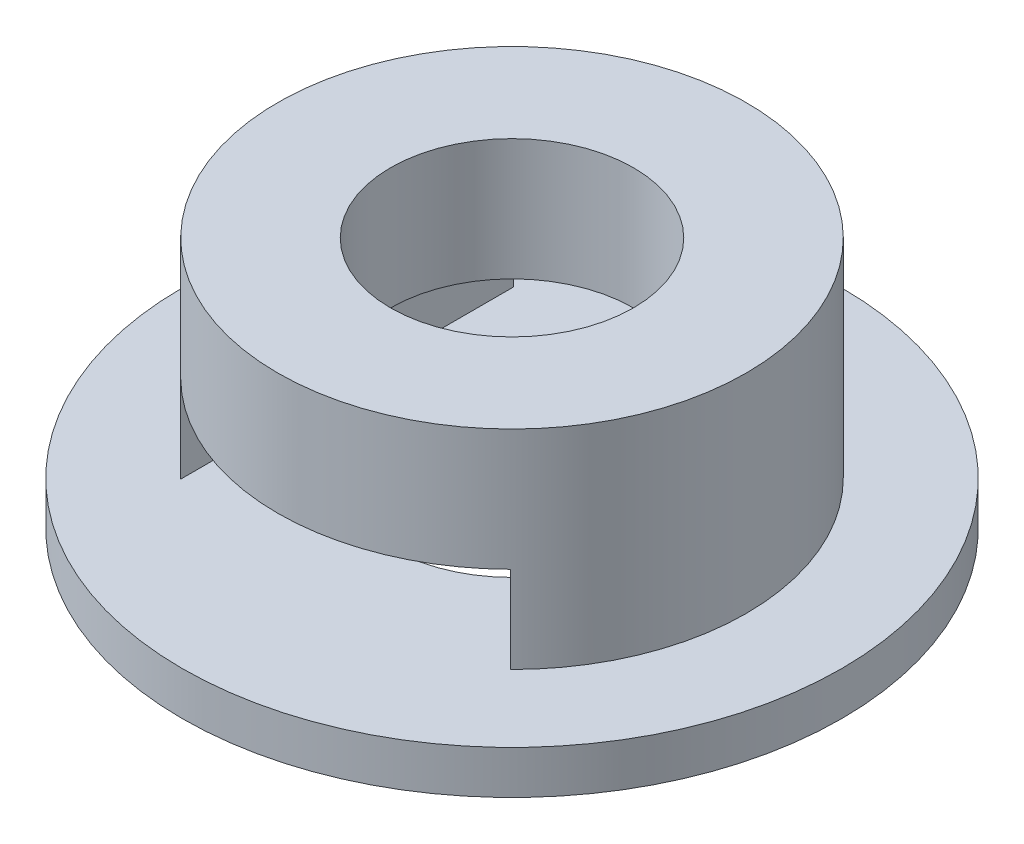
from build123d import *

# Parameters (mm, degrees)
SKETCH1_R           = 19
BOSS_EXTRUDE1_DEPTH = 2.5
SKETCH2_R           = 13.5
BOSS_EXTRUDE2_DEPTH = 12
SKETCH3_R           = 7
CUT_EXTRUDE1_DEPTH  = 31.532769282
SKETCH4_W           = 19
SKETCH4_H           = 5
CUT_EXTRUDE2_DEPTH  = 17.5


with BuildPart() as part:
    # Sketch1 → Boss-Extrude1 (new body)
    with BuildSketch(Plane(origin=(0, 0, 0), x_dir=(1, 0, 0), z_dir=(0, 1, 0))):
        with Locations(Location((0, 0, 0), (0, 0, 270))):
            Circle(SKETCH1_R)
    extrude(amount=BOSS_EXTRUDE1_DEPTH)

    # Sketch2 → Boss-Extrude2 (add)
    with BuildSketch(Plane(origin=(0, 2.5, 0), x_dir=(1, 0, 0), z_dir=(0, 1, 0))):
        with Locations(Location((0, 0, 0), (0, 0, 270))):
            Circle(SKETCH2_R)
    extrude(amount=BOSS_EXTRUDE2_DEPTH)

    # Sketch3 → Cut-Extrude1 (cut, through all)
    with BuildSketch(Plane(origin=(0, 14.5, 0), x_dir=(1, 0, 0), z_dir=(0, 1, 0))):
        with Locations(Location((0, 0, 0), (0, 0, 270))):
            Circle(SKETCH3_R)
    extrude(amount=-CUT_EXTRUDE1_DEPTH, mode=Mode.SUBTRACT)

    # Sketch4 → Cut-Extrude2 (cut, symmetric)
    with BuildSketch(Plane.XY):
        with Locations((0, 5)):
            Rectangle(SKETCH4_W, SKETCH4_H)
    extrude(amount=CUT_EXTRUDE2_DEPTH, both=True, mode=Mode.SUBTRACT)


solid = part.part
